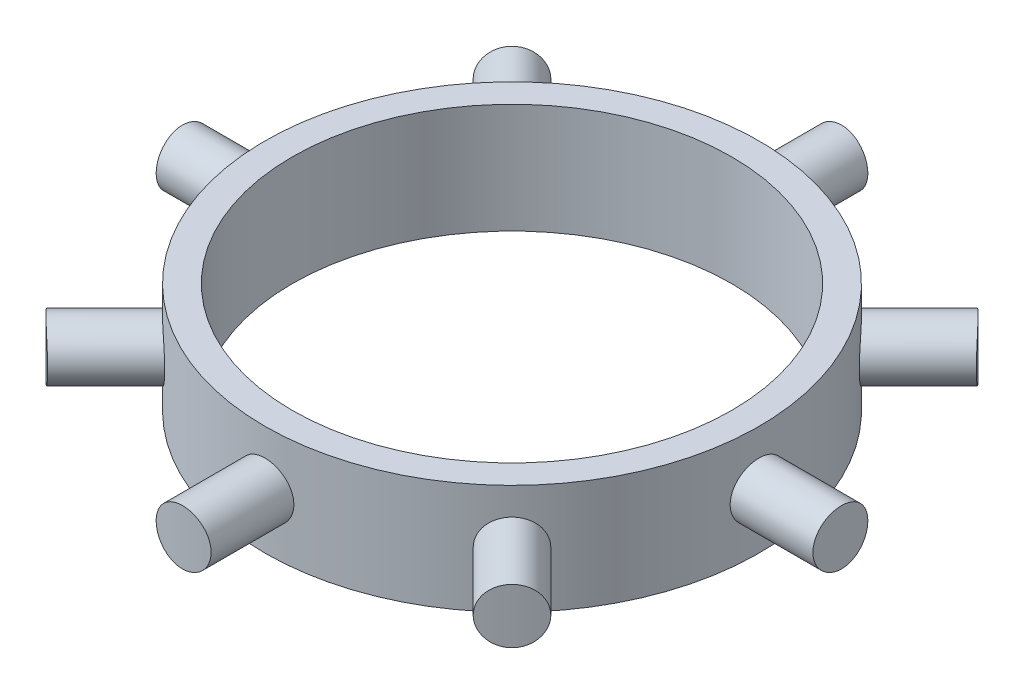
from build123d import *

# Parameters (mm, degrees)
SKETCH1_R           = 22.5
SKETCH1_R_2         = 20
BOSS_EXTRUDE1_DEPTH = 5
SKETCH4_R           = 2.5
BOSS_EXTRUDE3_DEPTH = 30
SKETCH5_R           = 20
CUT_EXTRUDE1_DEPTH  = 39.810436902
CIRPATTERN1_COUNT   = 8
SKETCH6_R           = 20
CUT_EXTRUDE2_DEPTH  = 44.588989596
SKETCH7_OUTSIDE_W   = 79.088
SKETCH7_OUTSIDE_H   = 79.088
SKETCH7_OUTSIDE_R   = 30
CUT_EXTRUDE4_DEPTH  = 44.588989596


with BuildPart() as part:
    # Sketch1 → Boss-Extrude1 (new, symmetric)
    with BuildSketch(Plane(origin=(0, 0, 0), x_dir=(1, 0, 0), z_dir=(0, 1, 0))):
        with Locations(Location((0, 0, 0), (0, 0, 270))):
            Circle(SKETCH1_R)
        with Locations(Location((0, 0, 0), (0, 0, 270))):
            Circle(SKETCH1_R_2, mode=Mode.SUBTRACT)
    extrude(amount=BOSS_EXTRUDE1_DEPTH, both=True)

    # Sketch4 → Boss-Extrude3 (add)
    with BuildSketch(Plane(origin=(0, 0, 0), x_dir=(0, 0, -1), z_dir=(1, 0, 0))):
        with Locations(Location((0, 0, 0), (0, 0, 180))):
            Circle(SKETCH4_R)
    boss_extrude3 = extrude(amount=BOSS_EXTRUDE3_DEPTH)

    # Sketch5 → Cut-Extrude1 (cut, through all)
    with BuildSketch(Plane.XZ.offset(5)):
        with Locations(Location((0, 0, 0), (0, 0, 90))):
            Circle(SKETCH5_R)
    extrude(amount=-CUT_EXTRUDE1_DEPTH, mode=Mode.SUBTRACT)

    # CirPattern1: Boss-Extrude3 ×8 about axis
    cirpattern1_axis = Axis((0, 0, 0), (0, 1, 0))
    for i in range(1, CIRPATTERN1_COUNT):
        add(boss_extrude3.rotate(cirpattern1_axis, i * 360 / CIRPATTERN1_COUNT))

    # Sketch6 → Cut-Extrude2 (cut, through all)
    with BuildSketch(Plane.XZ.offset(5)):
        with Locations(Location((0, 0, 0), (0, 0, 90))):
            Circle(SKETCH6_R)
    extrude(amount=-CUT_EXTRUDE2_DEPTH, mode=Mode.SUBTRACT)

    # Sketch7 outside → Cut-Extrude4 (cut, through all)
    with BuildSketch(Plane(origin=(0, 5, 0), x_dir=(1, 0, 0), z_dir=(0, 1, 0))):
        Rectangle(SKETCH7_OUTSIDE_W, SKETCH7_OUTSIDE_H)
        Circle(SKETCH7_OUTSIDE_R, mode=Mode.SUBTRACT)
    extrude(amount=-CUT_EXTRUDE4_DEPTH, mode=Mode.SUBTRACT)


solid = part.part
